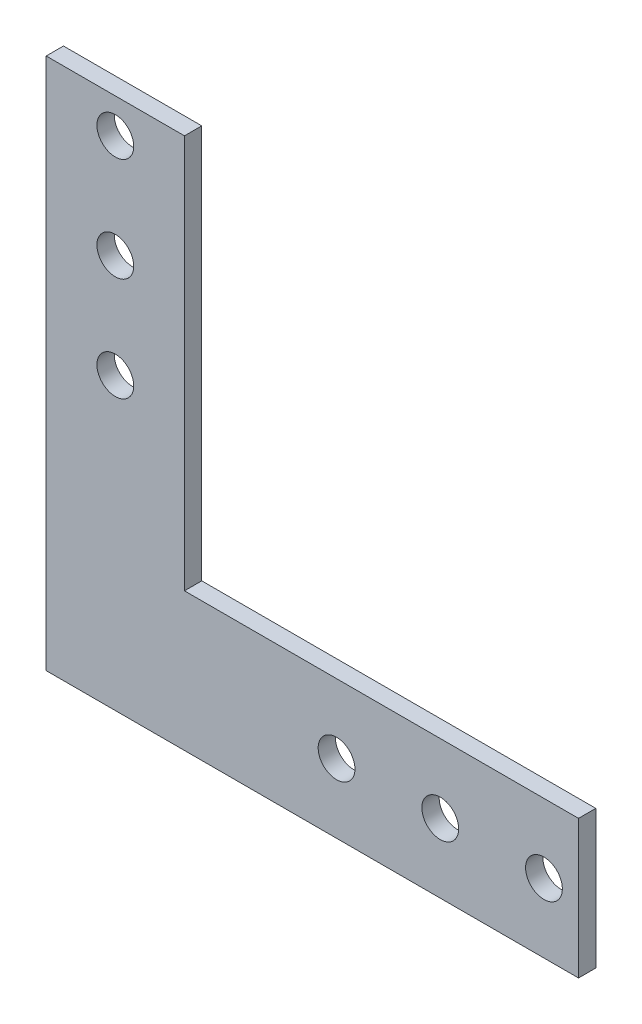
from build123d import *

# Parameters (mm, degrees)
BOSS_EXTRUDE1_DEPTH = 3.175
SKETCH2_R           = 3.3782
CUT_EXTRUDE1_DEPTH  = 139.332385308


with BuildPart() as part:
    # Sketch1 → Boss-Extrude1 (new body)
    with BuildSketch(Plane.XY):
        Polygon((0, 0), (0, 97.79), (25.4, 97.79), (25.4, 79.829487758), (25.4, 25.4), (79.829487758, 25.4), (97.79, 25.4), (97.79, 0), align=None)
    extrude(amount=BOSS_EXTRUDE1_DEPTH)

    # Sketch2 → Cut-Extrude1 (cut, through all)
    with BuildSketch(Plane.XY.offset(3.175)):
        with Locations((53.34, 12.7)):
            Circle(SKETCH2_R)
        with Locations((72.39, 12.7)):
            Circle(SKETCH2_R)
        with Locations((12.7, 53.34)):
            Circle(SKETCH2_R)
        with Locations((12.7, 72.39)):
            Circle(SKETCH2_R)
        with Locations((12.7, 91.44)):
            Circle(SKETCH2_R)
        with Locations((91.44, 12.7)):
            Circle(SKETCH2_R)
    extrude(amount=-CUT_EXTRUDE1_DEPTH, mode=Mode.SUBTRACT)


solid = part.part
